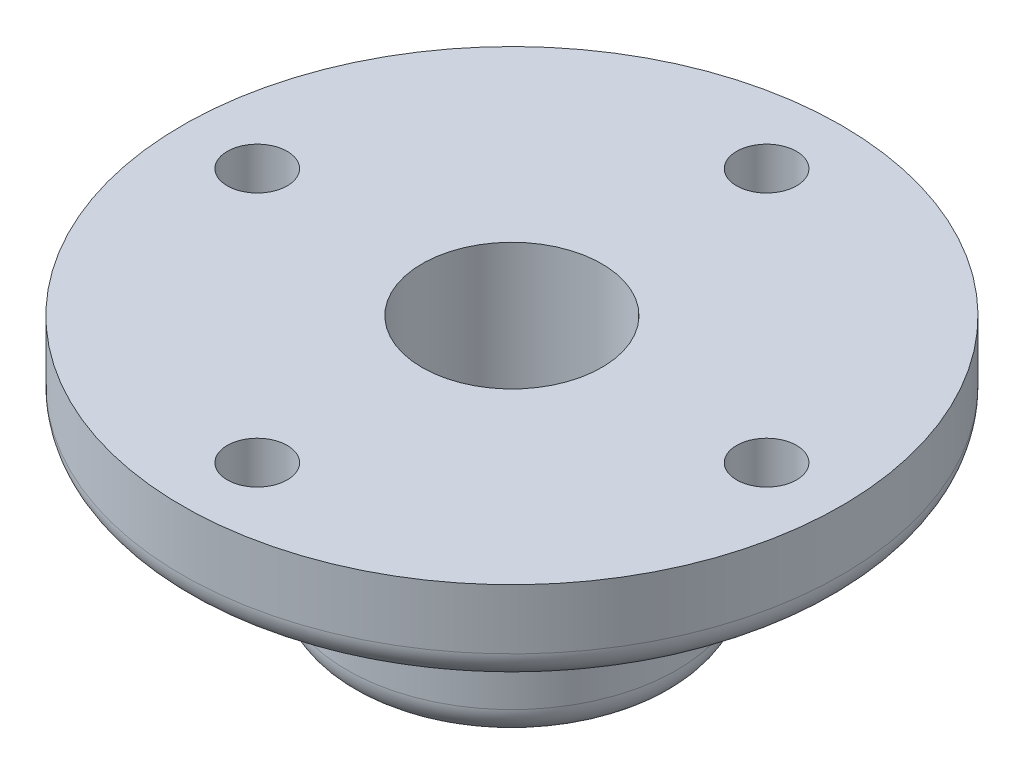
from build123d import *

# Parameters (mm, degrees)
SKETCH2_R          = 19.05
SKETCH2_R_2        = 6.35
CUT_EXTRUDE1_DEPTH = 113.567071735


with BuildPart() as part:
    # Sketch1 → Revolve1 (revolve)
    with BuildSketch(Plane(origin=(0, 0, 0), x_dir=(0, 0, -1), z_dir=(1, 0, 0))):
        with BuildLine():
            Line((34.925, 28.575), (34.925, 6.35))
            ThreePointArc((34.925, 6.35), (33.065128061, 1.859871939), (28.575, 0))
            Line((28.575, 0), (0, 0))
            Line((0, 0), (0, 53.975))
            Line((0, 53.975), (69.85, 53.975))
            Line((69.85, 53.975), (69.85, 41.275))
            ThreePointArc((69.85, 41.275), (67.990128061, 36.784871939), (63.5, 34.925))
            Line((63.5, 34.925), (41.275, 34.925))
            ThreePointArc((41.275, 34.925), (36.784871939, 33.065128061), (34.925, 28.575))
        make_face()
    revolve(axis=Axis((0, 0, 0), (0, 1, 0)))

    # Sketch2 → Cut-Extrude1 (cut, through all)
    with BuildSketch(Plane(origin=(0, 53.975, 0), x_dir=(1, 0, 0), z_dir=(0, 1, 0))):
        with Locations(Location((0, 0, 0), (0, 0, 270))):
            Circle(SKETCH2_R)
        with Locations(Location((0, 53.975, 0), (0, 0, 270))):
            Circle(SKETCH2_R_2)
        with Locations(Location((53.975, 0, 0), (0, 0, 270))):
            Circle(SKETCH2_R_2)
        with Locations(Location((0, -53.975, 0), (0, 0, 270))):
            Circle(SKETCH2_R_2)
        with Locations(Location((-53.975, 0, 0), (0, 0, 270))):
            Circle(SKETCH2_R_2)
    extrude(amount=-CUT_EXTRUDE1_DEPTH, mode=Mode.SUBTRACT)


solid = part.part
